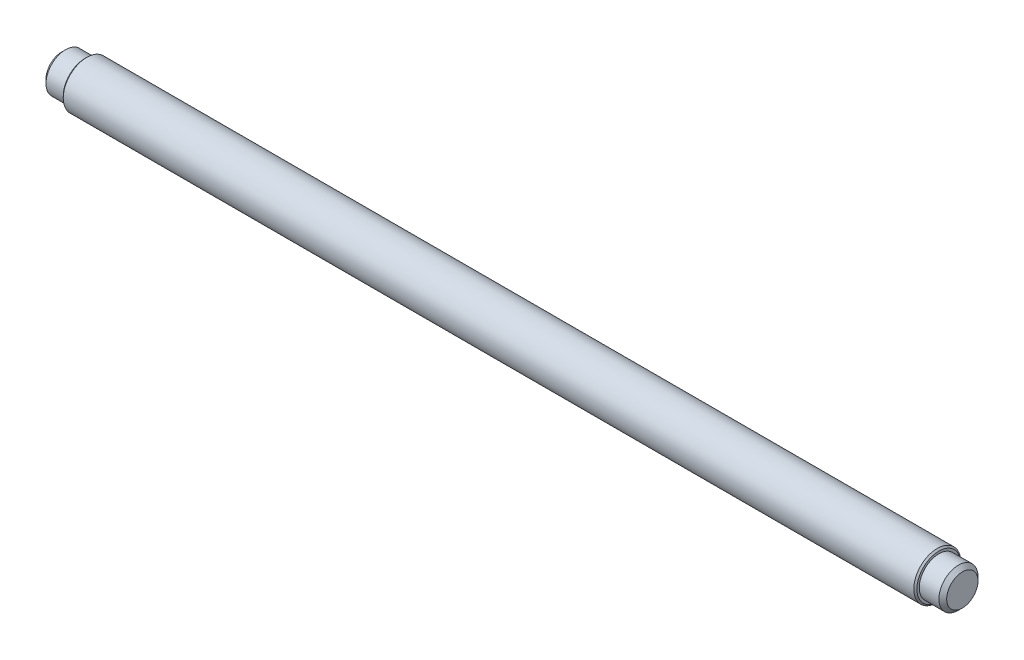
from build123d import *

# Parameters (mm, degrees)
CHAMFER1_SIZE = 0.2
CHAMFER2_SIZE = 0.2
CHAMFER3_SIZE = 0.5
CHAMFER4_SIZE = 0.5


with BuildPart() as part:
    # Sketch1 → Revolve1 (revolve)
    with BuildSketch(Plane.XY):
        Polygon((0, 0), (115, 0), (115, 2.5), (112, 2.5), (112, 3), (3, 3), (3, 2.5), (0, 2.5), align=None)
    revolve(axis=Axis((0, 0, 0), (1, 0, 0)))

    # Chamfer1
    chamfer1_edges = [part.edges().sort_by_distance(p)[0] for p in [
        (112, -3, 0),
    ]]
    chamfer(chamfer1_edges, length=CHAMFER1_SIZE)

    # Chamfer2
    chamfer2_edges = [part.edges().sort_by_distance(p)[0] for p in [
        (3, -3, 0),
    ]]
    chamfer(chamfer2_edges, length=CHAMFER2_SIZE)

    # Chamfer3
    chamfer3_edges = [part.edges().sort_by_distance(p)[0] for p in [
        (0, -2.5, 0),
    ]]
    chamfer(chamfer3_edges, length=CHAMFER3_SIZE)

    # Chamfer4
    chamfer4_edges = [part.edges().sort_by_distance(p)[0] for p in [
        (115, -2.5, 0),
    ]]
    chamfer(chamfer4_edges, length=CHAMFER4_SIZE)


solid = part.part
